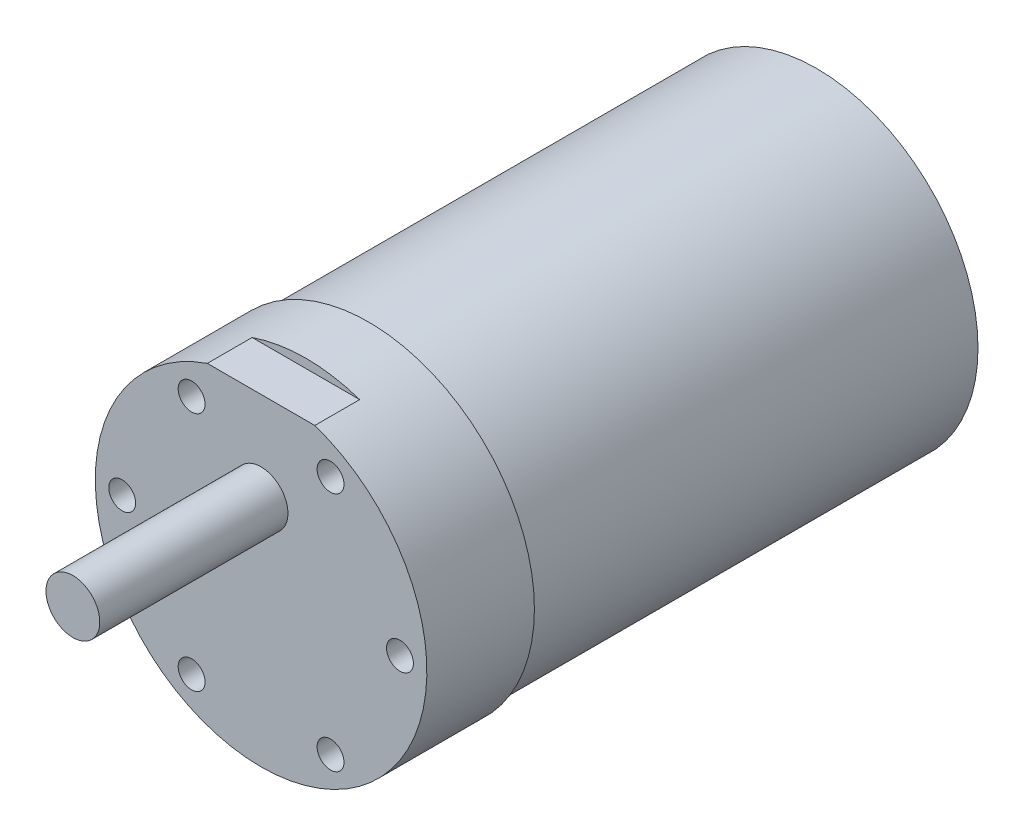
from build123d import *

# Parameters (mm, degrees)
SKETCH1_R           = 18.5
SKETCH1_R_2         = 1.5
SKETCH1_R_3         = 6.1
BOSS_EXTRUDE1_DEPTH = 12
SKETCH2_R           = 18
BOSS_EXTRUDE2_DEPTH = 50
SKETCH3_R           = 3
BOSS_EXTRUDE3_DEPTH = 21
SKETCH4_R           = 6.1
BOSS_EXTRUDE4_DEPTH = 12
CUT_EXTRUDE1_START  = -5
CUT_EXTRUDE1_DEPTH  = 5
SCALE1_SCALE        = 0.8
SCALE3_SCALE        = 1.1


with BuildPart() as part:
    # Sketch1 → Boss-Extrude1 (new body)
    with BuildSketch(Plane.XY):
        with Locations((6.10211523, 32.843167441)):
            Circle(SKETCH1_R)
        with Locations((21.60211523, 32.843167441)):
            Circle(SKETCH1_R_2, mode=Mode.SUBTRACT)
        with Locations((13.85211523, 19.419773682)):
            Circle(SKETCH1_R_2, mode=Mode.SUBTRACT)
        with Locations((-1.64788477, 19.419773682)):
            Circle(SKETCH1_R_2, mode=Mode.SUBTRACT)
        with Locations((-9.39788477, 32.843167441)):
            Circle(SKETCH1_R_2, mode=Mode.SUBTRACT)
        with Locations((-1.64788477, 46.266561199)):
            Circle(SKETCH1_R_2, mode=Mode.SUBTRACT)
        with Locations((13.85211523, 46.266561199)):
            Circle(SKETCH1_R_2, mode=Mode.SUBTRACT)
        with Locations((6.10211523, 40.343167441)):
            Circle(SKETCH1_R_3, mode=Mode.SUBTRACT)
    extrude(amount=BOSS_EXTRUDE1_DEPTH)

    # Sketch2 → Boss-Extrude2 (add)
    with BuildSketch(Plane(origin=(0, 0, 0), x_dir=(-1, 0, 0), z_dir=(0, 0, -1))):
        with Locations((-6.10211523, 32.843167441)):
            Circle(SKETCH2_R)
    extrude(amount=BOSS_EXTRUDE2_DEPTH)



with BuildPart() as body_2:
    # Sketch3 → Boss-Extrude3 (new body)
    with BuildSketch(Plane.XY.offset(12)):
        with Locations(Location((6.10211523, 40.343167441, 0), (0, 0, 180))):
            Circle(SKETCH3_R)
    extrude(amount=BOSS_EXTRUDE3_DEPTH)


with BuildPart() as part_1:
    add(part.part)

    add(body_2.part)  # Boss-Extrude4 merges body 2
    # Sketch4 → Boss-Extrude4 (add)
    with BuildSketch(Plane.XY):
        with Locations((6.10211523, 40.343167441)):
            Circle(SKETCH4_R)
    extrude(amount=BOSS_EXTRUDE4_DEPTH)

    # Sketch5 → Cut-Extrude1 (cut)
    with BuildSketch(Plane.XY.offset(12).offset(CUT_EXTRUDE1_START)):
        with BuildLine():
            Line((6.10211523, 50.343167441), (6.10211523, 51.343167441))
            ThreePointArc((6.10211523, 51.343167441), (3.060733965, 51.091455031), (0.10211523, 50.343167441))
            Line((0.10211523, 50.343167441), (6.10211523, 50.343167441))
        make_face()
        with BuildLine():
            ThreePointArc((12.10211523, 50.343167441), (9.143496496, 51.091455031), (6.10211523, 51.343167441))
            Line((6.10211523, 51.343167441), (6.10211523, 50.343167441))
            Line((6.10211523, 50.343167441), (12.10211523, 50.343167441))
        make_face()
    extrude(amount=CUT_EXTRUDE1_DEPTH, mode=Mode.SUBTRACT)


with BuildPart() as part_2:
    # Scale1: scaled about (6.10211523, 32.901644157, -18.561855602)
    add(part_1.part.scale(SCALE1_SCALE).moved(Location((1.220423046, 6.580328831, -3.71237112))))


with BuildPart() as part_3:
    # Scale3: scaled about (6.10211523, 32.901644157, -18.561855602)
    add(part_2.part.scale(SCALE3_SCALE).moved(Location((-0.610211523, -3.290164416, 1.85618556))))


solid = part_3.part
